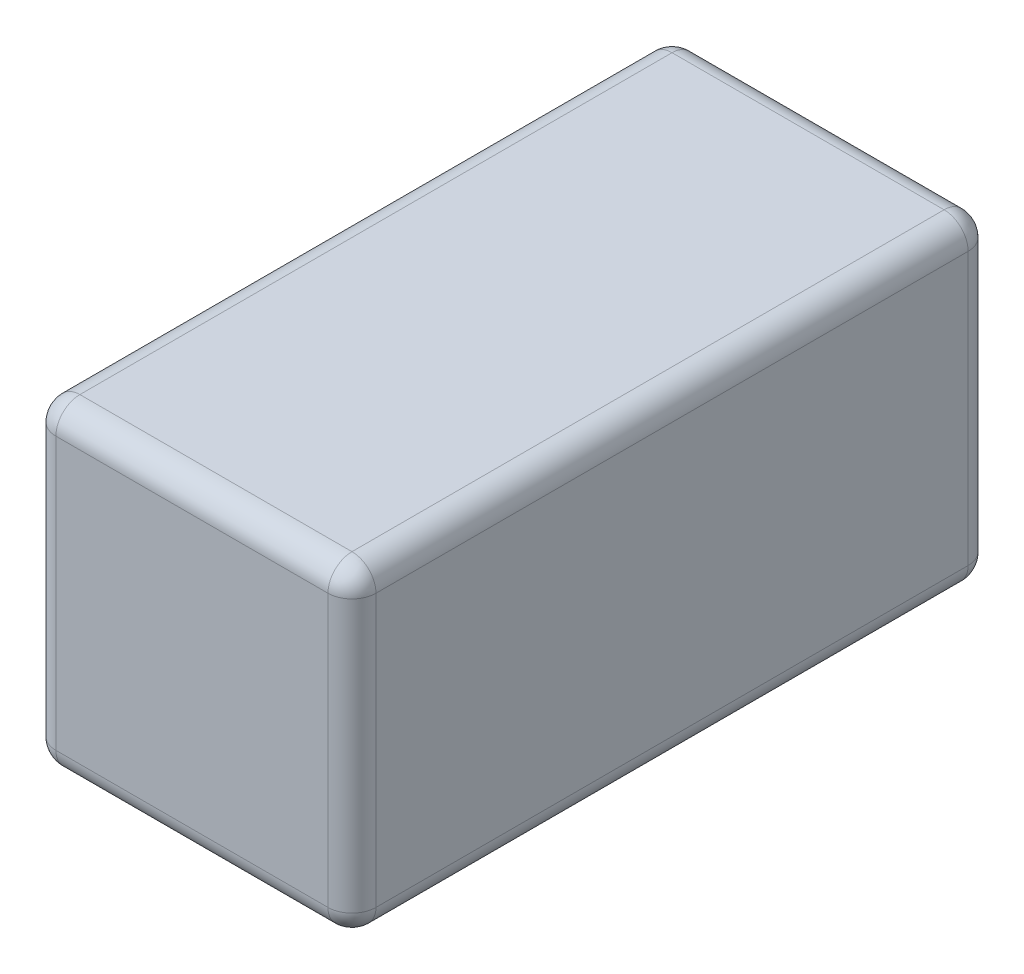
from build123d import *

# Parameters (mm, degrees)
SKETCH_1_W      = 4
SKETCH_1_H      = 4
EXTRUDE_1_DEPTH = 8
FILLET_2_R      = 0.3
FILLET_3_R      = 0.3
FILLET_4_R      = 0.3
FILLET_5_R      = 0.3
FILLET_6_R      = 0.3


with BuildPart() as part:
    # 草图1 → 凸台-拉伸1 (new body)
    with BuildSketch(Plane.XY):
        with Locations((2, 2)):
            Rectangle(SKETCH_1_W, SKETCH_1_H)
    extrude(amount=EXTRUDE_1_DEPTH)

    # 圆角2
    fillet_2_edges = [part.edges().sort_by_distance(p)[0] for p in [
        (2, 0, 0),
    ]]
    fillet(fillet_2_edges, radius=FILLET_2_R)

    # 圆角3
    fillet_3_edges = [part.edges().sort_by_distance(p)[0] for p in [
        (4, 2.15, 0),
        (4, 0.087867966, 0.087867966),
        (4, 0, 4.15),
    ]]
    fillet(fillet_3_edges, radius=FILLET_3_R)

    # 圆角4
    fillet_4_edges = [part.edges().sort_by_distance(p)[0] for p in [
        (0, 0.087867966, 0.087867966),
        (0, 2.15, 0),
        (0, 0, 4.15),
    ]]
    fillet(fillet_4_edges, radius=FILLET_4_R)

    # 圆角5
    fillet_5_edges = [part.edges().sort_by_distance(p)[0] for p in [
        (2, 4, 0),
        (3.912132034, 4, 0.087867966),
        (0.087867966, 4, 0.087867966),
        (0, 4, 4.15),
        (4, 4, 4.15),
    ]]
    fillet(fillet_5_edges, radius=FILLET_5_R)

    # 圆角6
    fillet_6_edges = [part.edges().sort_by_distance(p)[0] for p in [
        (4, 2, 8),
        (3.912132034, 0.087867966, 8),
        (2, 0, 8),
        (0.087867966, 0.087867966, 8),
        (2, 4, 8),
        (0, 2, 8),
        (0.087867966, 3.912132034, 8),
        (3.912132034, 3.912132034, 8),
    ]]
    fillet(fillet_6_edges, radius=FILLET_6_R)


solid = part.part
